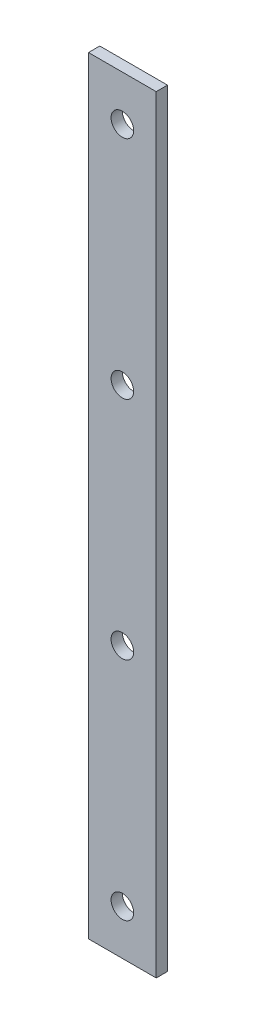
from build123d import *

# Parameters (mm, degrees)
SKETCH1_W           = 30
SKETCH1_H           = 340
SKETCH1_R           = 5
BOSS_EXTRUDE1_DEPTH = 5


with BuildPart() as part:
    # Sketch1 → Boss-Extrude1 (new body)
    with BuildSketch(Plane.XY):
        Rectangle(SKETCH1_W, SKETCH1_H)
        with Locations((0, -50)):
            Circle(SKETCH1_R, mode=Mode.SUBTRACT)
        with Locations((0, -150)):
            Circle(SKETCH1_R, mode=Mode.SUBTRACT)
        with Locations(Location((0, 50, 0), (0, 0, 180))):
            Circle(SKETCH1_R, mode=Mode.SUBTRACT)
        with Locations(Location((0, 150, 0), (0, 0, 180))):
            Circle(SKETCH1_R, mode=Mode.SUBTRACT)
    extrude(amount=BOSS_EXTRUDE1_DEPTH)


solid = part.part
